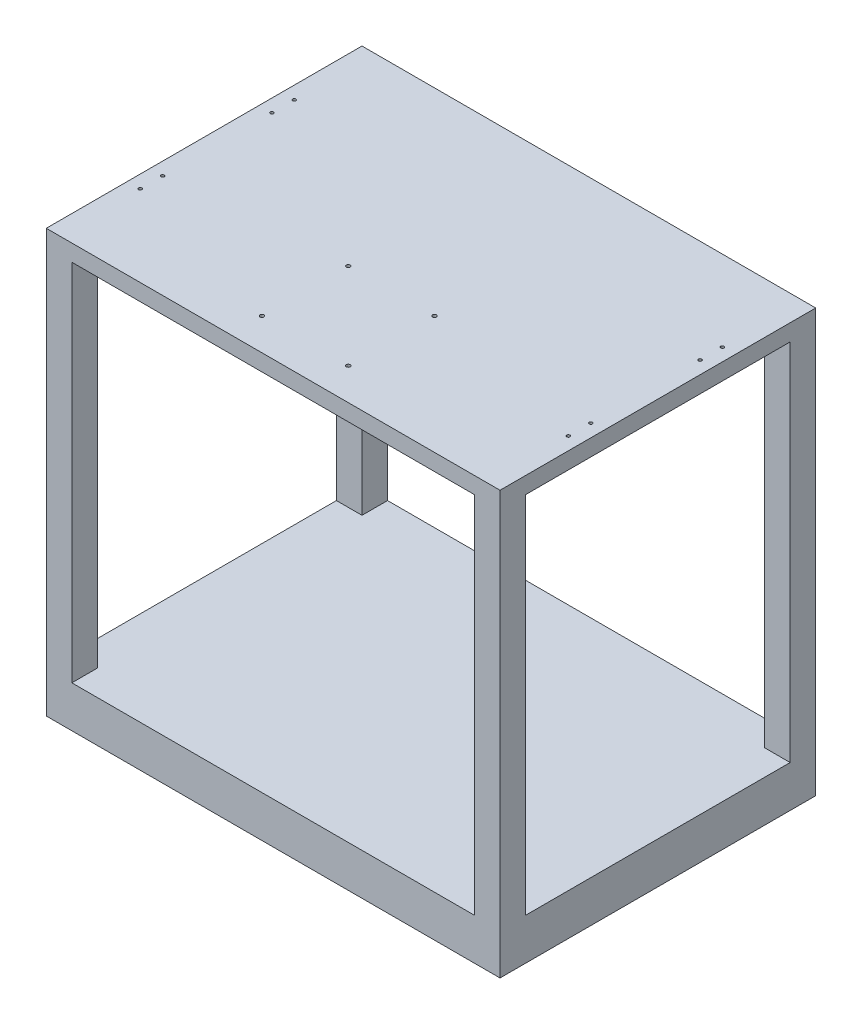
from build123d import *

# Parameters (mm, degrees)
SKETCH1_W           = 710
SKETCH1_H           = 494
BOSS_EXTRUDE1_DEPTH = 26
SKETCH2_R           = 3
CUT_EXTRUDE1_DEPTH  = 434.255121147
CUT_EXTRUDE2_REACH  = 435.255
SKETCH3_R           = 2.5
SKETCH4_W           = 40
SKETCH4_H           = 40
BOSS_EXTRUDE2_DEPTH = 570
SKETCH5_W           = 710
SKETCH5_H           = 494
BOSS_EXTRUDE3_DEPTH = 65


with BuildPart() as part:
    # Sketch1 → Boss-Extrude1 (new body)
    with BuildSketch(Plane(origin=(0, 0, 0), x_dir=(1, 0, 0), z_dir=(0, 1, 0))):
        Rectangle(SKETCH1_W, SKETCH1_H)
    extrude(amount=BOSS_EXTRUDE1_DEPTH)

    # Sketch2 → Cut-Extrude1 (cut, through all)
    with BuildSketch(Plane(origin=(0, 26, 0), x_dir=(1, 0, 0), z_dir=(0, 1, 0))):
        with Locations(Location((-67.5, -62, 0), (0, 0, 270))):
            Circle(SKETCH2_R)
        with Locations(Location((-67.5, -197, 0), (0, 0, 270))):
            Circle(SKETCH2_R)
        with Locations(Location((67.5, -197, 0), (0, 0, 270))):
            Circle(SKETCH2_R)
        with Locations(Location((67.5, -62, 0), (0, 0, 270))):
            Circle(SKETCH2_R)
    extrude(amount=-CUT_EXTRUDE1_DEPTH, mode=Mode.SUBTRACT)

    # Sketch3 → Cut-Extrude2 (cut, up to next)
    with BuildSketch(Plane(origin=(0, 26, 0), x_dir=(1, 0, 0), z_dir=(0, 1, 0)), mode=Mode.PRIVATE) as cut_extrude2_sk1:
        with Locations(Location((-335, 121, 0), (0, 0, 270))):
            Circle(SKETCH3_R)
    cut_extrude2_tool1 = extrude(cut_extrude2_sk1.sketch, amount=-CUT_EXTRUDE2_REACH, mode=Mode.PRIVATE) & part.part
    # Sketch3 → Cut-Extrude2 (cut, up to next)
    with BuildSketch(Plane(origin=(0, 26, 0), x_dir=(1, 0, 0), z_dir=(0, 1, 0)), mode=Mode.PRIVATE) as cut_extrude2_sk2:
        with Locations(Location((-335, 86, 0), (0, 0, 270))):
            Circle(SKETCH3_R)
    cut_extrude2_tool2 = extrude(cut_extrude2_sk2.sketch, amount=-CUT_EXTRUDE2_REACH, mode=Mode.PRIVATE) & part.part
    # Sketch3 → Cut-Extrude2 (cut, up to next)
    with BuildSketch(Plane(origin=(0, 26, 0), x_dir=(1, 0, 0), z_dir=(0, 1, 0)), mode=Mode.PRIVATE) as cut_extrude2_sk3:
        with Locations(Location((335, 86, 0), (0, 0, 270))):
            Circle(SKETCH3_R)
    cut_extrude2_tool3 = extrude(cut_extrude2_sk3.sketch, amount=-CUT_EXTRUDE2_REACH, mode=Mode.PRIVATE) & part.part
    # Sketch3 → Cut-Extrude2 (cut, up to next)
    with BuildSketch(Plane(origin=(0, 26, 0), x_dir=(1, 0, 0), z_dir=(0, 1, 0)), mode=Mode.PRIVATE) as cut_extrude2_sk4:
        with Locations(Location((335, 121, 0), (0, 0, 270))):
            Circle(SKETCH3_R)
    cut_extrude2_tool4 = extrude(cut_extrude2_sk4.sketch, amount=-CUT_EXTRUDE2_REACH, mode=Mode.PRIVATE) & part.part
    # Sketch3 → Cut-Extrude2 (cut, up to next)
    with BuildSketch(Plane(origin=(0, 26, 0), x_dir=(1, 0, 0), z_dir=(0, 1, 0)), mode=Mode.PRIVATE) as cut_extrude2_sk5:
        with Locations(Location((335, -85, 0), (0, 0, 270))):
            Circle(SKETCH3_R)
    cut_extrude2_tool5 = extrude(cut_extrude2_sk5.sketch, amount=-CUT_EXTRUDE2_REACH, mode=Mode.PRIVATE) & part.part
    # Sketch3 → Cut-Extrude2 (cut, up to next)
    with BuildSketch(Plane(origin=(0, 26, 0), x_dir=(1, 0, 0), z_dir=(0, 1, 0)), mode=Mode.PRIVATE) as cut_extrude2_sk6:
        with Locations(Location((335, -120, 0), (0, 0, 270))):
            Circle(SKETCH3_R)
    cut_extrude2_tool6 = extrude(cut_extrude2_sk6.sketch, amount=-CUT_EXTRUDE2_REACH, mode=Mode.PRIVATE) & part.part
    # Sketch3 → Cut-Extrude2 (cut, up to next)
    with BuildSketch(Plane(origin=(0, 26, 0), x_dir=(1, 0, 0), z_dir=(0, 1, 0)), mode=Mode.PRIVATE) as cut_extrude2_sk7:
        with Locations(Location((-335, -85, 0), (0, 0, 270))):
            Circle(SKETCH3_R)
    cut_extrude2_tool7 = extrude(cut_extrude2_sk7.sketch, amount=-CUT_EXTRUDE2_REACH, mode=Mode.PRIVATE) & part.part
    # Sketch3 → Cut-Extrude2 (cut, up to next)
    with BuildSketch(Plane(origin=(0, 26, 0), x_dir=(1, 0, 0), z_dir=(0, 1, 0)), mode=Mode.PRIVATE) as cut_extrude2_sk8:
        with Locations(Location((-335, -120, 0), (0, 0, 270))):
            Circle(SKETCH3_R)
    cut_extrude2_tool8 = extrude(cut_extrude2_sk8.sketch, amount=-CUT_EXTRUDE2_REACH, mode=Mode.PRIVATE) & part.part
    add(cut_extrude2_tool1.solids().sort_by_distance((-335, 26, -121))[0], mode=Mode.SUBTRACT)
    add(cut_extrude2_tool2.solids().sort_by_distance((-335, 26, -86))[0], mode=Mode.SUBTRACT)
    add(cut_extrude2_tool3.solids().sort_by_distance((335, 26, -86))[0], mode=Mode.SUBTRACT)
    add(cut_extrude2_tool4.solids().sort_by_distance((335, 26, -121))[0], mode=Mode.SUBTRACT)
    add(cut_extrude2_tool5.solids().sort_by_distance((335, 26, 85))[0], mode=Mode.SUBTRACT)
    add(cut_extrude2_tool6.solids().sort_by_distance((335, 26, 120))[0], mode=Mode.SUBTRACT)
    add(cut_extrude2_tool7.solids().sort_by_distance((-335, 26, 85))[0], mode=Mode.SUBTRACT)
    add(cut_extrude2_tool8.solids().sort_by_distance((-335, 26, 120))[0], mode=Mode.SUBTRACT)

    # Sketch4 → Boss-Extrude2 (add)
    with BuildSketch(Plane.XZ):
        with Locations((-335, 227)):
            Rectangle(SKETCH4_W, SKETCH4_H)
        with Locations((-335, -227)):
            Rectangle(SKETCH4_W, SKETCH4_H)
        with Locations((335, 227)):
            Rectangle(SKETCH4_W, SKETCH4_H)
        with Locations((335, -227)):
            Rectangle(SKETCH4_W, SKETCH4_H)
    extrude(amount=BOSS_EXTRUDE2_DEPTH)

    # Sketch5 → Boss-Extrude3 (add)
    with BuildSketch(Plane.XZ.offset(570)):
        Rectangle(SKETCH5_W, SKETCH5_H)
    extrude(amount=BOSS_EXTRUDE3_DEPTH)


solid = part.part
